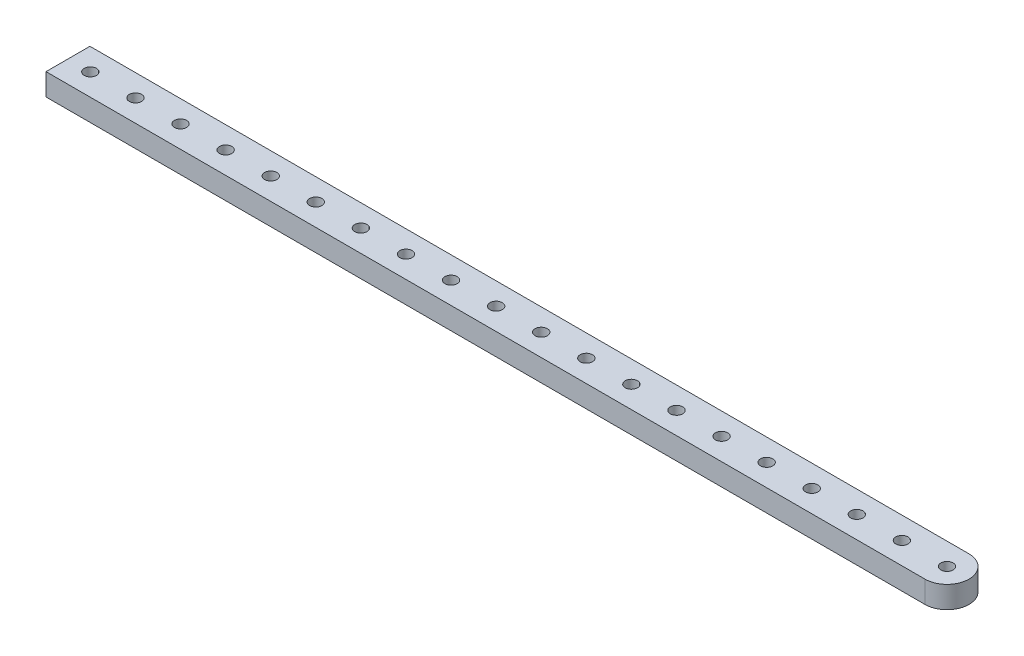
from build123d import *

# Parameters (mm, degrees)
SKETCH1_R           = 1.778
BOSS_EXTRUDE1_DEPTH = 6.35
SKETCH2_W           = 19.47523672
SKETCH2_H           = 16.524840043
CUT_EXTRUDE1_DEPTH  = 10.16


with BuildPart() as part:
    # Sketch1 → Boss-Extrude1 (new body)
    with BuildSketch(Plane(origin=(0, 6.35, 0), x_dir=(1, 0, 0), z_dir=(0, 1, 0))):
        with BuildLine():
            Line((130.386666667, 6.35), (-130.386666667, 6.35))
            ThreePointArc((-130.386666667, 6.35), (-136.736666667, 0), (-130.386666667, -6.35))
            Line((-130.386666667, -6.35), (130.386666667, -6.35))
            ThreePointArc((130.386666667, -6.35), (136.736666667, 0), (130.386666667, 6.35))
        make_face()
        with Locations(Location((130.386666667, 0, 0), (0, 0, 90))):
            Circle(SKETCH1_R, mode=Mode.SUBTRACT)
        with Locations(Location((117.348, 0, 0), (0, 0, 90))):
            Circle(SKETCH1_R, mode=Mode.SUBTRACT)
        with Locations(Location((104.309333333, 0, 0), (0, 0, 90))):
            Circle(SKETCH1_R, mode=Mode.SUBTRACT)
        with Locations(Location((91.270666667, 0, 0), (0, 0, 90))):
            Circle(SKETCH1_R, mode=Mode.SUBTRACT)
        with Locations(Location((78.232, 0, 0), (0, 0, 90))):
            Circle(SKETCH1_R, mode=Mode.SUBTRACT)
        with Locations(Location((65.193333333, 0, 0), (0, 0, 90))):
            Circle(SKETCH1_R, mode=Mode.SUBTRACT)
        with Locations(Location((52.154666667, 0, 0), (0, 0, 90))):
            Circle(SKETCH1_R, mode=Mode.SUBTRACT)
        with Locations(Location((39.116, 0, 0), (0, 0, 90))):
            Circle(SKETCH1_R, mode=Mode.SUBTRACT)
        with Locations(Location((26.077333333, 0, 0), (0, 0, 90))):
            Circle(SKETCH1_R, mode=Mode.SUBTRACT)
        with Locations(Location((13.038666667, 0, 0), (0, 0, 90))):
            Circle(SKETCH1_R, mode=Mode.SUBTRACT)
        with Locations(Location((0, 0, 0), (0, 0, 90))):
            Circle(SKETCH1_R, mode=Mode.SUBTRACT)
        with Locations(Location((-13.038666667, 0, 0), (0, 0, 90))):
            Circle(SKETCH1_R, mode=Mode.SUBTRACT)
        with Locations(Location((-26.077333333, 0, 0), (0, 0, 90))):
            Circle(SKETCH1_R, mode=Mode.SUBTRACT)
        with Locations(Location((-39.116, 0, 0), (0, 0, 90))):
            Circle(SKETCH1_R, mode=Mode.SUBTRACT)
        with Locations(Location((-52.154666667, 0, 0), (0, 0, 90))):
            Circle(SKETCH1_R, mode=Mode.SUBTRACT)
        with Locations(Location((-65.193333333, 0, 0), (0, 0, 90))):
            Circle(SKETCH1_R, mode=Mode.SUBTRACT)
        with Locations(Location((-78.232, 0, 0), (0, 0, 90))):
            Circle(SKETCH1_R, mode=Mode.SUBTRACT)
        with Locations(Location((-91.270666667, 0, 0), (0, 0, 90))):
            Circle(SKETCH1_R, mode=Mode.SUBTRACT)
        with Locations(Location((-104.309333333, 0, 0), (0, 0, 90))):
            Circle(SKETCH1_R, mode=Mode.SUBTRACT)
        with Locations(Location((-117.348, 0, 0), (0, 0, 90))):
            Circle(SKETCH1_R, mode=Mode.SUBTRACT)
        with Locations(Location((-130.386666667, 0, 0), (0, 0, 90))):
            Circle(SKETCH1_R, mode=Mode.SUBTRACT)
    extrude(amount=-BOSS_EXTRUDE1_DEPTH)

    # Sketch2 → Cut-Extrude1 (cut)
    with BuildSketch(Plane(origin=(0, 6.35, 0), x_dir=(1, 0, 0), z_dir=(0, 1, 0))):
        with Locations((-133.562235071, -1.347885805)):
            Rectangle(SKETCH2_W, SKETCH2_H)
    extrude(amount=-CUT_EXTRUDE1_DEPTH, mode=Mode.SUBTRACT)


solid = part.part
